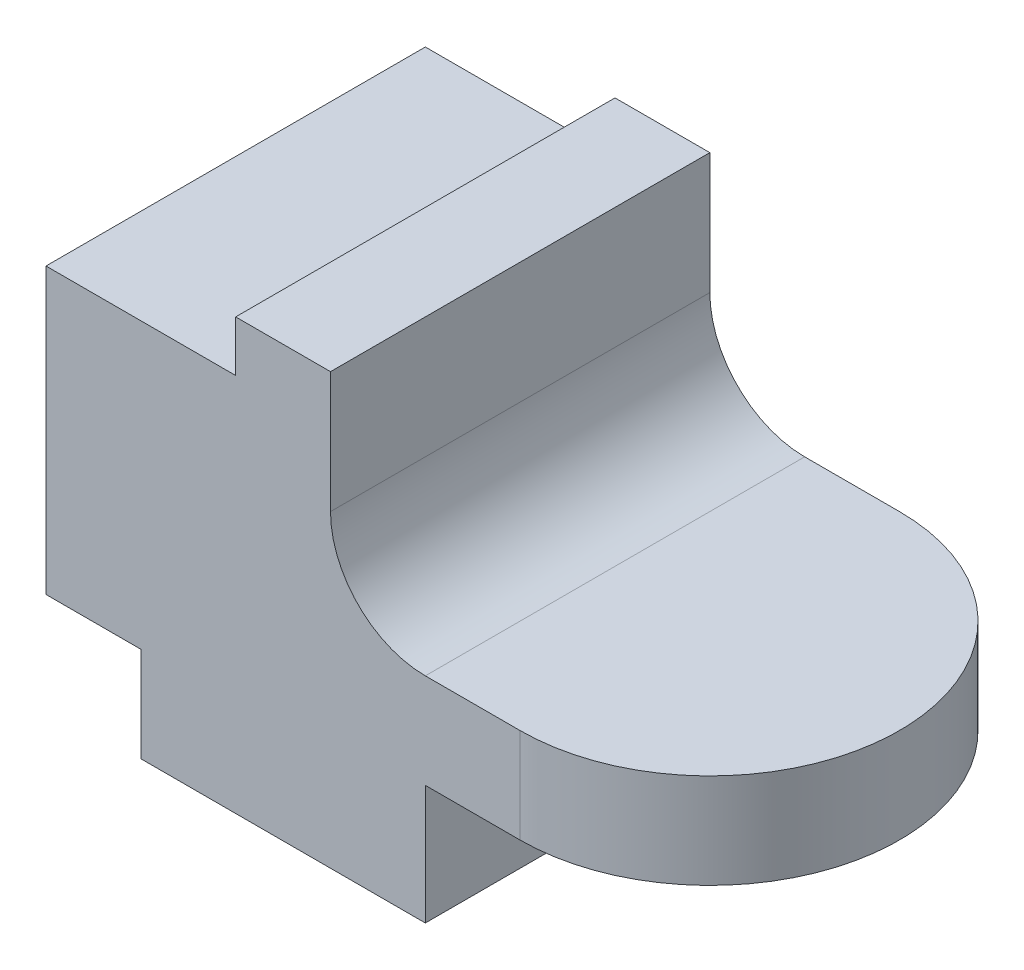
from build123d import *

# Parameters (mm, degrees)
BOSS_EXTRUDE1_DEPTH = 40
SKETCH3_OUTSIDE_W   = 90.5
SKETCH3_OUTSIDE_H   = 60.5
CUT_EXTRUDE1_DEPTH  = 40


with BuildPart() as part:
    # Sketch1 → Boss-Extrude1 (new body)
    with BuildSketch(Plane.XY):
        with BuildLine():
            Line((-15.809128631, 23.900414938), (-5.809128631, 23.900414938))
            Line((-5.809128631, 23.900414938), (-5.809128631, 11.12033195))
            ThreePointArc((-5.809128631, 11.12033195), (-2.880196443, 4.049264138), (4.190871369, 1.12033195))
            Line((4.190871369, 1.12033195), (34.190871369, 1.12033195))
            Line((34.190871369, 1.12033195), (34.190871369, -8.87966805))
            Line((34.190871369, -8.87966805), (4.190871369, -8.87966805))
            Line((4.190871369, -8.87966805), (4.190871369, -21.452282158))
            Line((4.190871369, -21.452282158), (-25.809128631, -21.452282158))
            Line((-25.809128631, -21.452282158), (-25.809128631, -11.452282158))
            Line((-25.809128631, -11.452282158), (-35.809128631, -11.452282158))
            Line((-35.809128631, -11.452282158), (-35.809128631, 18.547717842))
            Line((-35.809128631, 18.547717842), (-15.809128631, 18.547717842))
            Line((-15.809128631, 18.547717842), (-15.809128631, 23.900414938))
        make_face()
    extrude(amount=BOSS_EXTRUDE1_DEPTH)

    # Sketch3 outside → Cut-Extrude1 (cut)
    with BuildSketch(Plane(origin=(0, 1.12033195, 0), x_dir=(1, 0, 0), z_dir=(0, 1, 0))):
        with Locations((-0.809, -20)):
            Rectangle(SKETCH3_OUTSIDE_W, SKETCH3_OUTSIDE_H)
        with BuildLine():
            Line((14.190871369, 0), (-35.809128631, 0))
            Line((-35.809128631, 0), (-35.809128631, -40))
            Line((-35.809128631, -40), (14.190871369, -40))
            ThreePointArc((14.190871369, -40), (34.190871369, -20), (14.190871369, 0))
        make_face(mode=Mode.SUBTRACT)
    extrude(amount=-CUT_EXTRUDE1_DEPTH, mode=Mode.SUBTRACT)


solid = part.part
